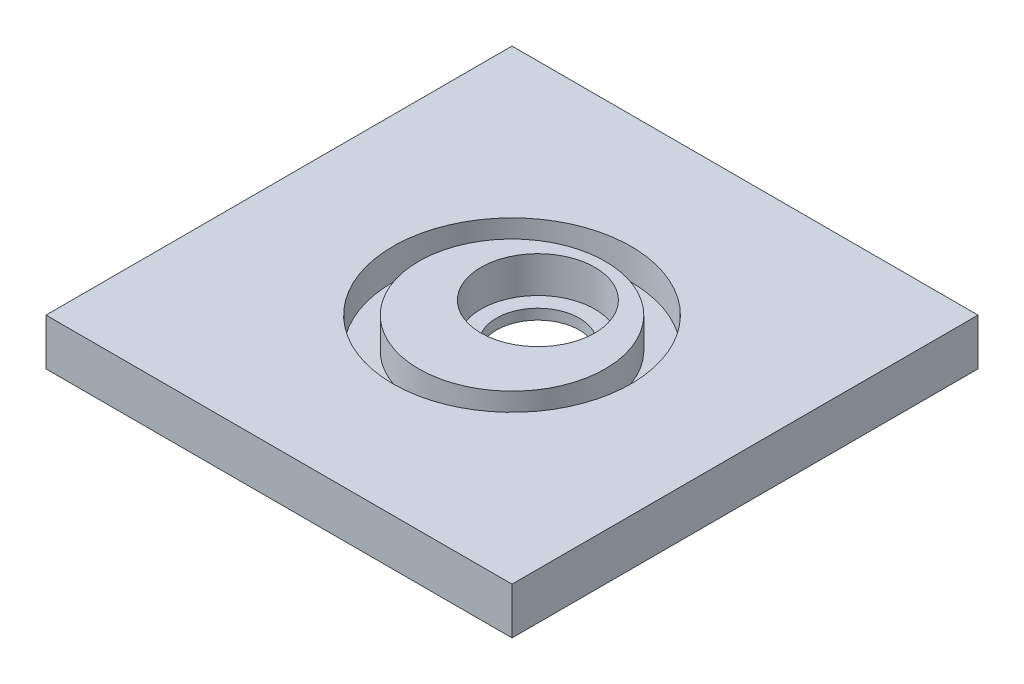
from build123d import *

# Parameters (mm, degrees)
SKETCH_1_W          = 45
SKETCH_1_H          = 45
EXTRUDE_1_DEPTH     = 4.5
SKETCH_2_R          = 5.5
CUT_EXTRUDE_1_DEPTH = 3.5
SKETCH_3_R          = 4
CUT_EXTRUDE_2_DEPTH = 33.011716605
SKETCH_4_R          = 11.5
SKETCH_4_R_2        = 9
CUT_EXTRUDE_3_DEPTH = 3


with BuildPart() as part:
    # 草图1 → 凸台-拉伸1 (new body)
    with BuildSketch(Plane(origin=(0, 0, 0), x_dir=(1, 0, 0), z_dir=(0, 1, 0))):
        Rectangle(SKETCH_1_W, SKETCH_1_H)
    extrude(amount=EXTRUDE_1_DEPTH)

    # 草图2 → 切除-拉伸1 (cut)
    with BuildSketch(Plane(origin=(0, 4.5, 0), x_dir=(1, 0, 0), z_dir=(0, 1, 0))):
        with Locations(Location((0, 2.5, 0), (0, 0, 270))):
            Circle(SKETCH_2_R)
    extrude(amount=-CUT_EXTRUDE_1_DEPTH, mode=Mode.SUBTRACT)

    # 草图3 → 切除-拉伸2 (cut, through all)
    with BuildSketch(Plane(origin=(0, 1, 0), x_dir=(1, 0, 0), z_dir=(0, 1, 0))):
        with Locations(Location((0, 2.5, 0), (0, 0, 270))):
            Circle(SKETCH_3_R)
    extrude(amount=-CUT_EXTRUDE_2_DEPTH, mode=Mode.SUBTRACT)

    # 草图4 → 切除-拉伸3 (cut)
    with BuildSketch(Plane(origin=(0, 4.5, 0), x_dir=(1, 0, 0), z_dir=(0, 1, 0))):
        with Locations(Location((0, 0, 0), (0, 0, 270))):
            Circle(SKETCH_4_R)
        with Locations(Location((0, 0, 0), (0, 0, 270))):
            Circle(SKETCH_4_R_2, mode=Mode.SUBTRACT)
    extrude(amount=-CUT_EXTRUDE_3_DEPTH, mode=Mode.SUBTRACT)


solid = part.part
